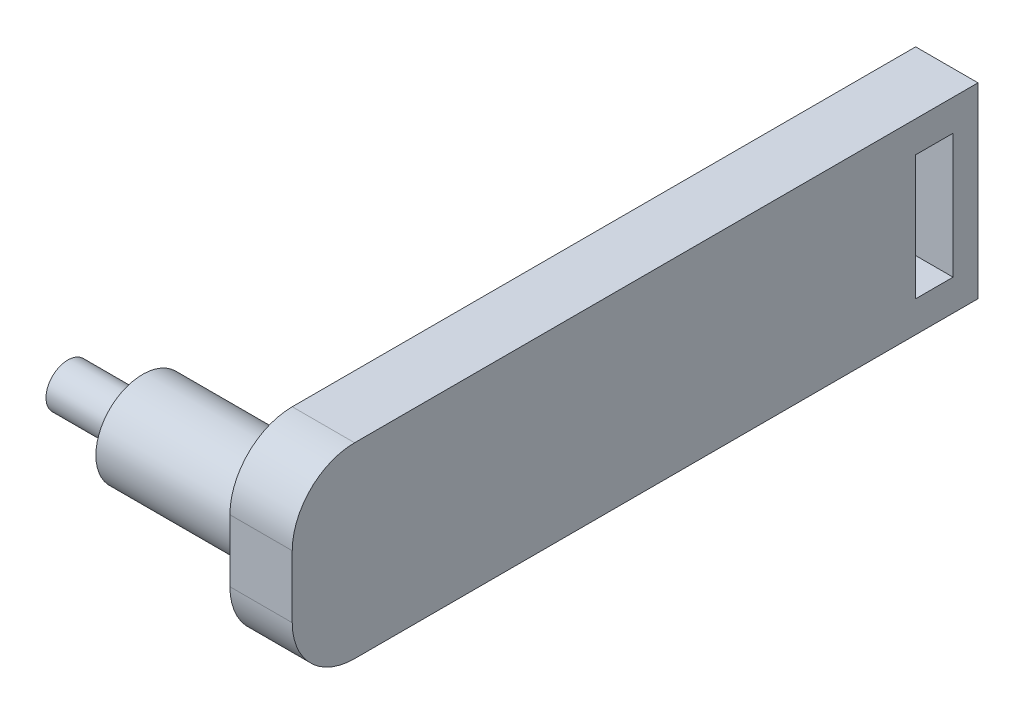
from build123d import *

# Parameters (mm, degrees)
SKETCH1_W           = 5
SKETCH1_H           = 55
BOSS_EXTRUDE1_DEPTH = 15
FILLET1_R           = 5
SKETCH2_W           = 3
SKETCH2_H           = 10
CUT_EXTRUDE1_DEPTH  = 5
SKETCH3_R           = 3.75
BOSS_EXTRUDE2_DEPTH = 12
SKETCH4_R           = 1.75
BOSS_EXTRUDE3_DEPTH = 6


with BuildPart() as part:
    # Sketch1 → Boss-Extrude1 (new body)
    with BuildSketch(Plane(origin=(0, 0, 0), x_dir=(1, 0, 0), z_dir=(0, 1, 0))):
        with Locations((-59.380536913, 1.290268456)):
            Rectangle(SKETCH1_W, SKETCH1_H)
    extrude(amount=BOSS_EXTRUDE1_DEPTH)

    # Fillet1
    fillet1_edges = [part.edges().sort_by_distance(p)[0] for p in [
        (-59.380536913, 15, 26.209731544),
        (-59.380536913, 0, 26.209731544),
    ]]
    fillet(fillet1_edges, radius=FILLET1_R)

    # Sketch2 → Cut-Extrude1 (cut)
    with BuildSketch(Plane.ZY.offset(61.880536913)):
        with Locations((-25.290268456, 7.5)):
            Rectangle(SKETCH2_W, SKETCH2_H)
    extrude(amount=-CUT_EXTRUDE1_DEPTH, mode=Mode.SUBTRACT)

    # Sketch3 → Boss-Extrude2 (add)
    with BuildSketch(Plane.ZY.offset(61.880536913)):
        with Locations((21.209731544, 7.5)):
            Circle(SKETCH3_R)
    extrude(amount=BOSS_EXTRUDE2_DEPTH)

    # Sketch4 → Boss-Extrude3 (add)
    with BuildSketch(Plane.ZY.offset(73.880536913)):
        with Locations((21.209731544, 7.5)):
            Circle(SKETCH4_R)
    extrude(amount=BOSS_EXTRUDE3_DEPTH)


solid = part.part
